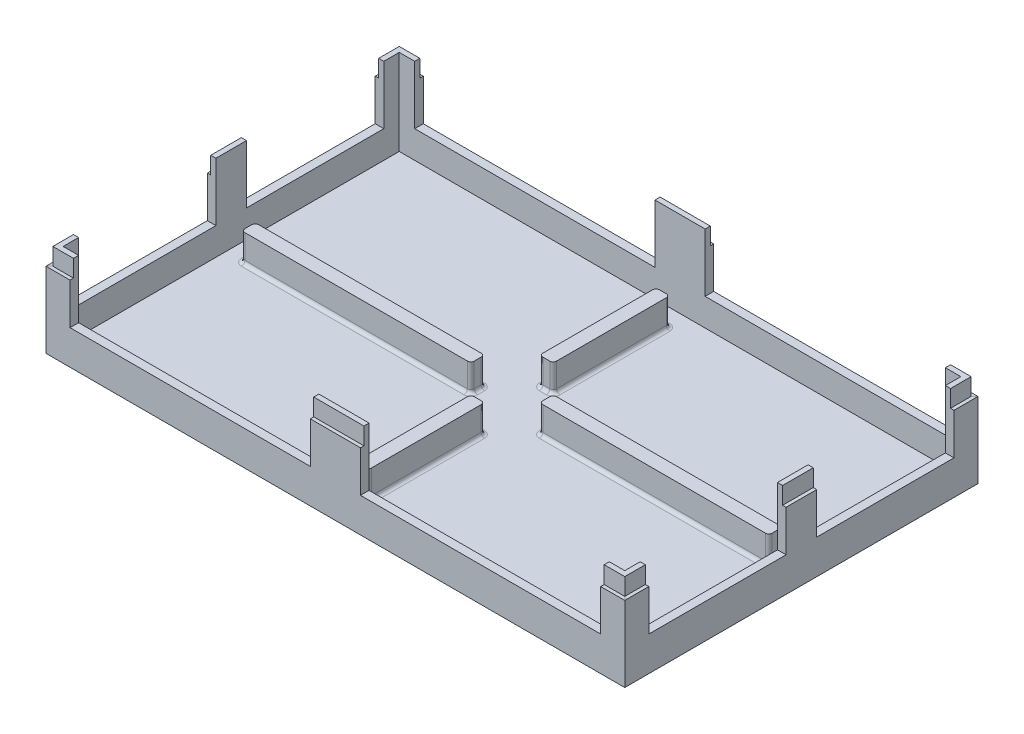
from build123d import *

# Parameters (mm, degrees)
SKETCH1_W               = 166.62
SKETCH1_H               = 100.92
SKETCH1_W_2             = 79.81
SKETCH1_H_2             = 46.96
BOSS_EXTRUDE1_DEPTH     = 25
SKETCH2_W               = 166.62
SKETCH2_H               = 100.92
BOSS_EXTRUDE2_DEPTH     = 2
SKETCH3_W               = 20
SKETCH3_H               = 20
SKETCH3_W_2             = 5
SKETCH3_H_2             = 30
SKETCH3_W_3             = 25
SKETCH3_H_3             = 5
CUT_EXTRUDE1_DEPTH      = 101.557285663
SKETCH4_W               = 168.62
SKETCH4_H               = 102.92
SKETCH4_W_2             = 166.62
SKETCH4_H_2             = 100.92
BOSS_EXTRUDE3_DEPTH     = 27
FILLET1_R               = 1
SKETCH5_W               = 1
SKETCH5_H               = 5
SKETCH8_W               = 70
SKETCH8_H               = 44.022863743
CUT_EXTRUDE2_DEPTH      = 136.372458425
CUT_EXTRUDE3_DEPTH      = 2
CUT_EXTRUDE3_DEPTH_BACK = 179.061326514
SKETCH9_W               = 40
SKETCH9_H               = 21.691425142


with BuildPart() as part:
    # Sketch1 → Boss-Extrude1 (new body)
    with BuildSketch(Plane(origin=(0, 0, 0), x_dir=(1, 0, 0), z_dir=(0, 1, 0))):
        Rectangle(SKETCH1_W, SKETCH1_H)
        with Locations((41.905, 25.48)):
            Rectangle(SKETCH1_W_2, SKETCH1_H_2, mode=Mode.SUBTRACT)
        with Locations((41.905, -25.48)):
            Rectangle(SKETCH1_W_2, SKETCH1_H_2, mode=Mode.SUBTRACT)
        with Locations((-41.905, 25.48)):
            Rectangle(SKETCH1_W_2, SKETCH1_H_2, mode=Mode.SUBTRACT)
        with Locations((-41.905, -25.48)):
            Rectangle(SKETCH1_W_2, SKETCH1_H_2, mode=Mode.SUBTRACT)
    extrude(amount=BOSS_EXTRUDE1_DEPTH)

    # Sketch2 → Boss-Extrude2 (add)
    with BuildSketch(Plane.XZ):
        Rectangle(SKETCH2_W, SKETCH2_H)
    extrude(amount=BOSS_EXTRUDE2_DEPTH)

    # Sketch3 → Cut-Extrude1 (cut, through all)
    with BuildSketch(Plane(origin=(0, 0, 0), x_dir=(1, 0, 0), z_dir=(0, 1, 0))):
        Rectangle(SKETCH3_W, SKETCH3_H)
        with Locations((-79.31, 0)):
            Rectangle(SKETCH3_W_2, SKETCH3_H_2)
        with Locations((0, 46.46)):
            Rectangle(SKETCH3_W_3, SKETCH3_H_3)
        with Locations((0, -46.46)):
            Rectangle(SKETCH3_W_3, SKETCH3_H_3)
        with Locations((79.31, 0)):
            Rectangle(SKETCH3_W_2, SKETCH3_H_2)
    extrude(amount=CUT_EXTRUDE1_DEPTH, mode=Mode.SUBTRACT)

    # Sketch4 → Boss-Extrude3 (add)
    with BuildSketch(Plane.XZ.offset(2)):
        Rectangle(SKETCH4_W, SKETCH4_H)
        Rectangle(SKETCH4_W_2, SKETCH4_H_2, mode=Mode.SUBTRACT)
    extrude(amount=-BOSS_EXTRUDE3_DEPTH)

    # Fillet1
    fillet1_edges = [part.edges().sort_by_distance(p)[0] for p in [
        (-43.405, 0, 2),
        (43.405, 0, -2),
        (43.405, 25, -2),
        (-43.405, 25, 2),
        (2, 25, 26.98),
        (-2, 25, -26.98),
        (-10, 12.5, -2),
        (-10, 0, 0),
        (-10, 12.5, 2),
        (0, 0, 10),
        (2, 12.5, 10),
        (-2, 12.5, 10),
        (10, 12.5, 2),
        (10, 0, 0),
        (10, 12.5, -2),
        (0, 0, -10),
        (-2, 12.5, -10),
        (2, 12.5, -10),
        (-43.405, 0, -2),
        (-43.405, 25, -2),
        (-76.81, 0, 0),
        (-76.81, 12.5, -2),
        (-76.81, 12.5, 2),
        (2, 0, -26.98),
        (2, 25, -26.98),
        (-2, 12.5, -43.96),
        (0, 0, -43.96),
        (2, 12.5, -43.96),
        (-2, 0, 26.98),
        (-2, 25, 26.98),
        (2, 12.5, 43.96),
        (0, 0, 43.96),
        (-2, 12.5, 43.96),
        (43.405, 0, 2),
        (43.405, 25, 2),
        (76.81, 0, 0),
        (76.81, 12.5, 2),
        (76.81, 12.5, -2),
        (-2, 0, -26.98),
        (2, 0, 26.98),
    ]]
    fillet(fillet1_edges, radius=FILLET1_R)

    # Cut-Sweep1: sweep along a path in Sketch7
    with BuildLine(Plane(origin=(0, 25, 0), x_dir=(1, 0, 0), z_dir=(0, 1, 0))) as cut_sweep1_path:
        Line((-84.31, -51.46), (84.31, -51.46))
        Line((84.31, -51.46), (84.31, 51.46))
        Line((84.31, 51.46), (-84.31, 51.46))
        Line((-84.31, 51.46), (-84.31, -51.46))
    # Sketch5 → Cut-Sweep1 (sweep, cut)
    with BuildSketch(Plane(origin=(84.31, 0, 0), x_dir=(0, 0, -1), z_dir=(1, 0, 0))):
        with Locations((-50.96, 22.5)):
            Rectangle(SKETCH5_W, SKETCH5_H)
    sweep(path=cut_sweep1_path.line, transition=Transition.RIGHT, mode=Mode.SUBTRACT)

    # Sketch8 → Cut-Extrude2 (cut, through all)
    with BuildSketch(Plane.XY.offset(51.46)):
        with Locations((-42.31, 30.011431872)):
            Rectangle(SKETCH8_W, SKETCH8_H)
        with Locations((42.31, 30.011431872)):
            Rectangle(SKETCH8_W, SKETCH8_H)
    extrude(amount=-CUT_EXTRUDE2_DEPTH, mode=Mode.SUBTRACT)

    # Sketch9 → Cut-Extrude3 (cut, two sides: drawn at the far end of the back side and taken through both)
    with BuildSketch(Plane(origin=(84.31, 0, 0), x_dir=(0, 0, -1), z_dir=(1, 0, 0)).offset(-CUT_EXTRUDE3_DEPTH_BACK)):
        with Locations((-24.46, 18.845712571)):
            Rectangle(SKETCH9_W, SKETCH9_H)
        with Locations((24.46, 18.845712571)):
            Rectangle(SKETCH9_W, SKETCH9_H)
    extrude(amount=CUT_EXTRUDE3_DEPTH + CUT_EXTRUDE3_DEPTH_BACK, mode=Mode.SUBTRACT)


solid = part.part
